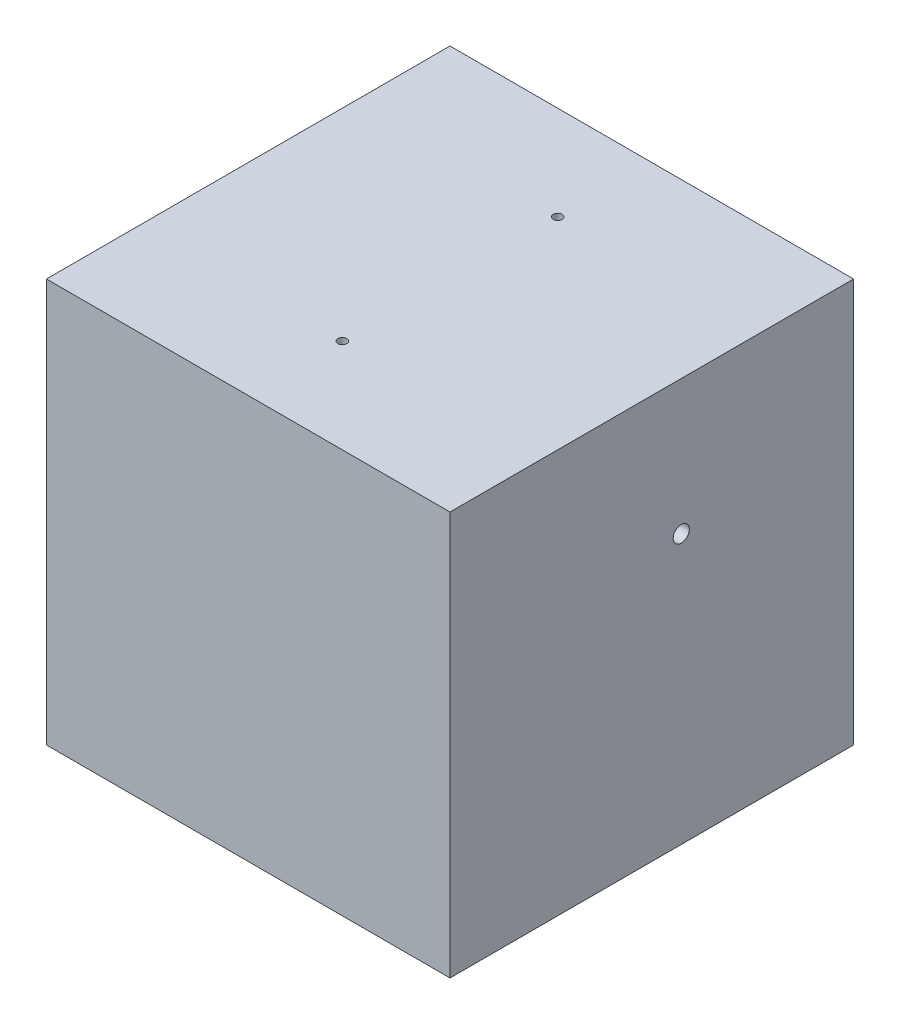
from build123d import *

# Parameters (mm, degrees)
SKETCH_1_W          = 150
SKETCH_1_H          = 150
EXTRUDE_1_DEPTH     = 5
SKETCH_3_W          = 150
SKETCH_3_H          = 150
SKETCH_3_W_2        = 140
SKETCH_3_H_2        = 140
EXTRUDE_2_DEPTH     = 140
SKETCH_5_R          = 1.65
CUT_EXTRUDE_1_DEPTH = 5
SKETCH_8_W          = 150
SKETCH_8_H          = 150
SKETCH_8_R          = 50
EXTRUDE_3_DEPTH     = 5
SKETCH_7_R          = 3
CUT_EXTRUDE_2_DEPTH = 257.953303151


with BuildPart() as part:
    # 草图1 → 凸台-拉伸1 (new body)
    with BuildSketch(Plane(origin=(0, 0, 0), x_dir=(1, 0, 0), z_dir=(0, 1, 0))):
        with Locations((75, 75)):
            Rectangle(SKETCH_1_W, SKETCH_1_H)
    extrude(amount=EXTRUDE_1_DEPTH)

    # 草图3 → 凸台-拉伸2 (add)
    with BuildSketch(Plane.XZ):
        with Locations((75, -75)):
            Rectangle(SKETCH_3_W, SKETCH_3_H)
        with Locations((75, -75)):
            Rectangle(SKETCH_3_W_2, SKETCH_3_H_2, mode=Mode.SUBTRACT)
    extrude(amount=EXTRUDE_2_DEPTH)

    # 草图5 → 切除-拉伸1 (cut)
    with BuildSketch(Plane(origin=(0, 5, 0), x_dir=(1, 0, 0), z_dir=(0, 1, 0))):
        with Locations(Location((75, 115, 0), (0, 0, 270))):
            Circle(SKETCH_5_R)
        with Locations(Location((75, 35, 0), (0, 0, 90))):
            Circle(SKETCH_5_R)
    extrude(amount=-CUT_EXTRUDE_1_DEPTH, mode=Mode.SUBTRACT)

    # 草图8 → 凸台-拉伸3 (add)
    with BuildSketch(Plane.XZ.offset(140)):
        with Locations((75, -75)):
            Rectangle(SKETCH_8_W, SKETCH_8_H)
        with Locations(Location((75, -75, 0), (0, 0, 270))):
            Circle(SKETCH_8_R, mode=Mode.SUBTRACT)
    extrude(amount=EXTRUDE_3_DEPTH)

    # 草图7 → 切除-拉伸2 (cut, through all)
    with BuildSketch(Plane(origin=(150, 0, 0), x_dir=(0, 0, -1), z_dir=(1, 0, 0))):
        with Locations((85.95, -45)):
            Circle(SKETCH_7_R)
    extrude(amount=-CUT_EXTRUDE_2_DEPTH, mode=Mode.SUBTRACT)


solid = part.part
